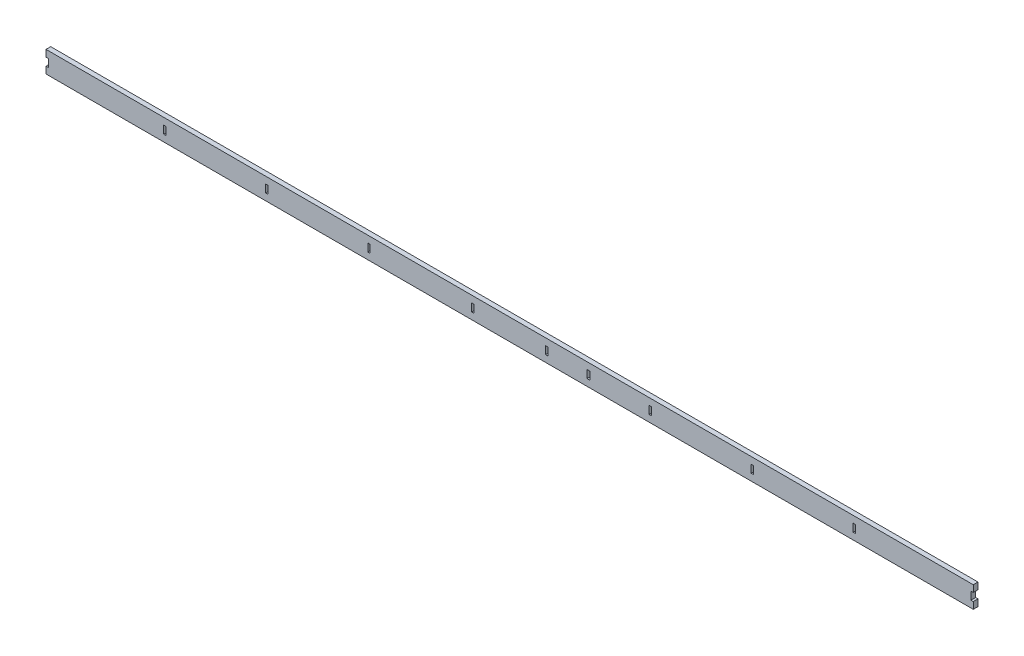
from build123d import *

# Parameters (mm, degrees)
MODEL_W         = 2
MODEL_H         = 5
EXTRUDE_2_DEPTH = 3


with BuildPart() as part:
    # Model → 凸台-拉伸2 (new body)
    with BuildSketch(Plane.XY):
        Polygon((575.240468194, 18.879736589), (-15.555770015, 18.879736589), (-15.555770015, 14.579736589), (-14.055770015, 14.579736589), (-14.055770015, 9.579736589), (-15.555770015, 9.579736589), (-15.555770015, 5.279736589), (575.240468194, 5.279736589), (575.240468194, 9.579736589), (573.740468194, 9.579736589), (573.740468194, 14.579736589), (575.240468194, 14.579736589), align=None)
        with Locations((330.144145491, 12.079736589)):
            Rectangle(MODEL_W, MODEL_H, mode=Mode.SUBTRACT)
        Polygon((59.444206817, 12.079736589), (59.444206817, 14.579736589), (60.944206817, 14.579736589), (60.944206817, 9.579736589), (59.444206817, 9.579736589), align=None, mode=Mode.SUBTRACT)
        Polygon((124.444183648, 12.079736589), (124.444183648, 14.579736589), (125.944183648, 14.579736589), (125.944183648, 9.579736589), (124.444183648, 9.579736589), align=None, mode=Mode.SUBTRACT)
        Polygon((189.444160479, 12.079736589), (189.444160479, 14.579736589), (190.944160479, 14.579736589), (190.944160479, 9.579736589), (189.444160479, 9.579736589), align=None, mode=Mode.SUBTRACT)
        Polygon((255.644137473, 12.079741496), (255.644137473, 14.579741496), (257.144137473, 14.579741496), (257.144137473, 9.579741496), (255.644137473, 9.579741496), align=None, mode=Mode.SUBTRACT)
        Polygon((302.644147585, 12.079741496), (302.644147585, 14.579741496), (304.144147585, 14.579741496), (304.144147585, 9.579741496), (302.644147585, 9.579741496), align=None, mode=Mode.SUBTRACT)
        Polygon((368.740539794, 12.079741496), (368.740539794, 14.579741496), (370.240539794, 14.579741496), (370.240539794, 9.579741496), (368.740539794, 9.579741496), align=None, mode=Mode.SUBTRACT)
        Polygon((433.740516625, 12.079741496), (433.740516625, 14.579741496), (435.240516625, 14.579741496), (435.240516625, 9.579741496), (433.740516625, 9.579741496), align=None, mode=Mode.SUBTRACT)
        Polygon((498.740493457, 12.079741496), (498.740493457, 14.579741496), (500.240493457, 14.579741496), (500.240493457, 9.579741496), (498.740493457, 9.579741496), align=None, mode=Mode.SUBTRACT)
    extrude(amount=EXTRUDE_2_DEPTH)


solid = part.part
